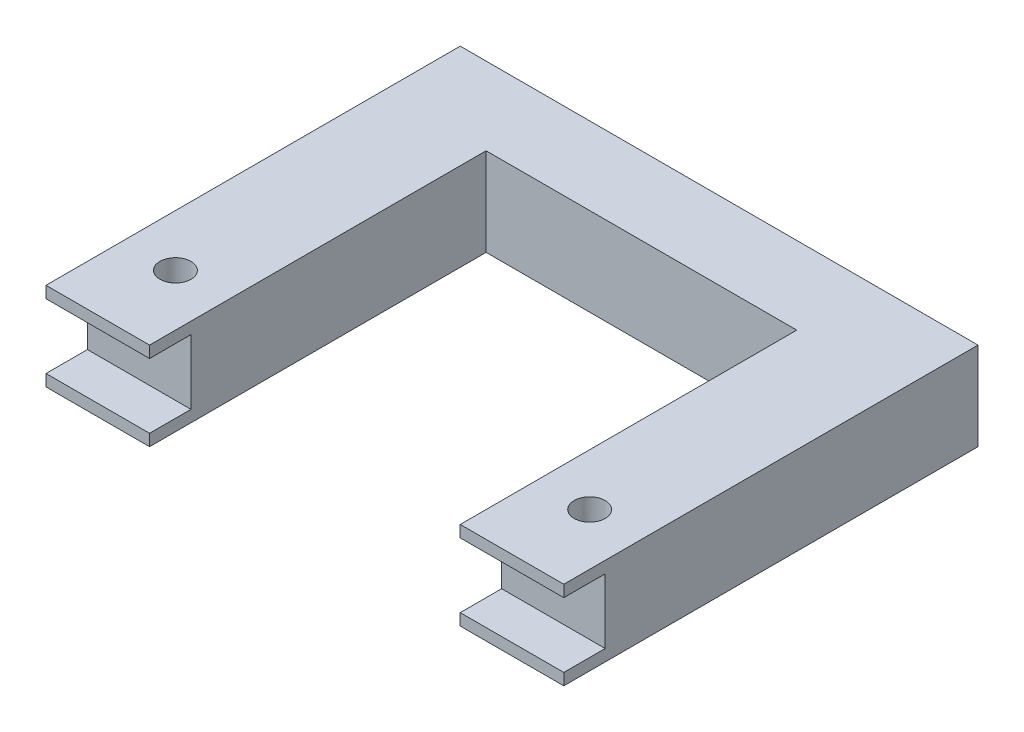
from build123d import *

# Parameters (mm, degrees)
SALIENTE_EXTRUIR1_DEPTH = 17
CROQUIS2_W              = 100
CROQUIS2_H              = 12.5
CORTAR_EXTRUIR1_DEPTH   = 8
CROQUIS3_R              = 3
CORTAR_EXTRUIR2_DEPTH   = 17


with BuildPart() as part:
    # Croquis1 → Saliente-Extruir1 (new body)
    with BuildSketch(Plane(origin=(0, 0, 0), x_dir=(1, 0, 0), z_dir=(0, 1, 0))):
        Polygon((0, 0), (-20, 0), (-20, 80), (80, 80), (80, 0), (60, 0), (60, 65), (0, 65), align=None)
    extrude(amount=SALIENTE_EXTRUIR1_DEPTH)

    # Croquis2 → Cortar-Extruir1 (cut)
    with BuildSketch(Plane.XY):
        with Locations((30, 8.5)):
            Rectangle(CROQUIS2_W, CROQUIS2_H)
    extrude(amount=-CORTAR_EXTRUIR1_DEPTH, mode=Mode.SUBTRACT)

    # Croquis3 → Cortar-Extruir2 (cut)
    with BuildSketch(Plane(origin=(0, 17, 0), x_dir=(1, 0, 0), z_dir=(0, 1, 0))):
        with Locations(Location((-10, 15, 0), (0, 0, 270))):
            Circle(CROQUIS3_R)
        with Locations(Location((70, 15, 0), (0, 0, 270))):
            Circle(CROQUIS3_R)
    extrude(amount=-CORTAR_EXTRUIR2_DEPTH, mode=Mode.SUBTRACT)


solid = part.part
